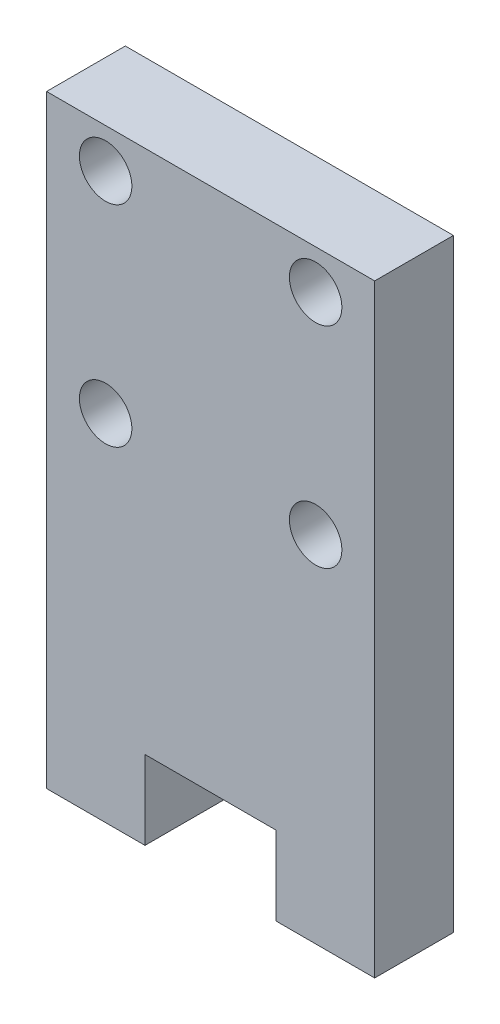
from build123d import *

# Parameters (mm, degrees)
ESQUISSE1_W             = 25
ESQUISSE1_H             = 40
BOSS_EXTRU_1_DEPTH      = 6
ESQUISSE2_R             = 1.005
ENL_V_MAT_EXTRU_1_DEPTH = 6
ESQUISSE3_R             = 2
ENL_V_MAT_EXTRU_2_DEPTH = 3
ESQUISSE4_W             = 7.5
ESQUISSE4_H             = 6
BOSS_EXTRU_2_DEPTH      = 6


with BuildPart() as part:
    # Esquisse1 → Boss.-Extru.1 (new body)
    with BuildSketch(Plane.XY):
        with Locations((12.5, 20)):
            Rectangle(ESQUISSE1_W, ESQUISSE1_H)
    extrude(amount=BOSS_EXTRU_1_DEPTH)

    # Esquisse2 → Enlèv. mat.-Extru.1 (cut)
    with BuildSketch(Plane.XY.offset(6)):
        with Locations((4.5, 37)):
            Circle(ESQUISSE2_R)
        with Locations((20.5, 37)):
            Circle(ESQUISSE2_R)
        with Locations((4.5, 21)):
            Circle(ESQUISSE2_R)
        with Locations((20.5, 21)):
            Circle(ESQUISSE2_R)
    extrude(amount=-ENL_V_MAT_EXTRU_1_DEPTH, mode=Mode.SUBTRACT)

    # Esquisse3 → Enlèv. mat.-Extru.2 (cut)
    with BuildSketch(Plane.XY.offset(6)):
        with Locations((4.5, 37)):
            Circle(ESQUISSE3_R)
        with Locations((20.5, 37)):
            Circle(ESQUISSE3_R)
        with Locations((4.5, 21)):
            Circle(ESQUISSE3_R)
        with Locations((20.5, 21)):
            Circle(ESQUISSE3_R)
    extrude(amount=-ENL_V_MAT_EXTRU_2_DEPTH, mode=Mode.SUBTRACT)

    # Esquisse4 → Boss.-Extru.2 (add)
    with BuildSketch(Plane.XZ):
        with Locations((3.75, 3)):
            Rectangle(ESQUISSE4_W, ESQUISSE4_H)
        with Locations((21.25, 3)):
            Rectangle(ESQUISSE4_W, ESQUISSE4_H)
    extrude(amount=BOSS_EXTRU_2_DEPTH)


solid = part.part
